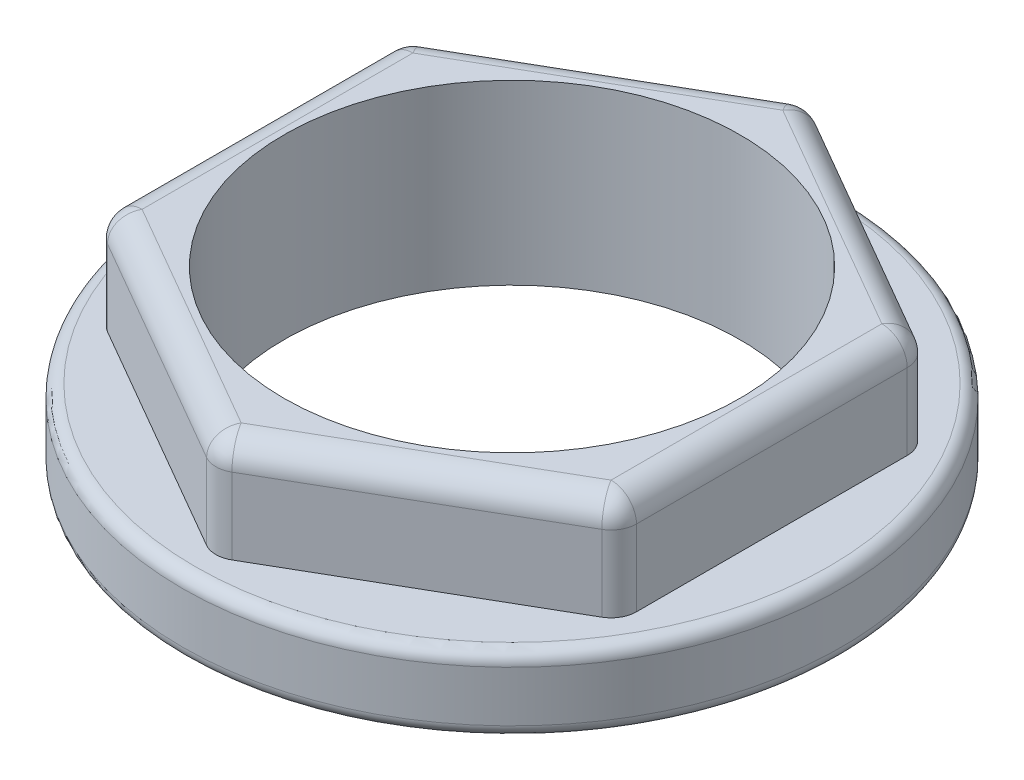
from build123d import *

# Parameters (mm, degrees)
ESQUISSE1_R        = 13
ESQUISSE1_R_2      = 9
BOSS_EXTRU_1_DEPTH = 3
ESQUISSE2_R        = 9
BOSS_EXTRU_2_DEPTH = 4
CONG_2_R           = 1
CONG_3_R           = 0.5


with BuildPart() as part:
    # Esquisse1 → Boss.-Extru.1 (new body)
    with BuildSketch(Plane(origin=(0, 0, 0), x_dir=(1, 0, 0), z_dir=(0, 1, 0))):
        with Locations(Location((0, 0, 0), (0, 0, 270))):
            Circle(ESQUISSE1_R)
        with Locations(Location((0, 0, 0), (0, 0, 270))):
            Circle(ESQUISSE1_R_2, mode=Mode.SUBTRACT)
    extrude(amount=BOSS_EXTRU_1_DEPTH)

    # Esquisse2 → Boss.-Extru.2 (add)
    with BuildSketch(Plane(origin=(0, 3, 0), x_dir=(1, 0, 0), z_dir=(0, 1, 0))):
        Polygon((10.25, -5.917840259), (10.25, 5.917840259), (0, 11.835680518), (-10.25, 5.917840259), (-10.25, -5.917840259), (0, -11.835680518), align=None)
        with Locations(Location((0, 0, 0), (0, 0, 270))):
            Circle(ESQUISSE2_R, mode=Mode.SUBTRACT)
    extrude(amount=BOSS_EXTRU_2_DEPTH)

    # Congé2
    cong_2_edges = [part.edges().sort_by_distance(p)[0] for p in [
        (5.125, 7, 8.876760389),
        (10.25, 7, 0),
        (5.125, 7, -8.876760389),
        (-5.125, 7, -8.876760389),
        (-10.25, 7, 0),
        (-5.125, 7, 8.876760389),
        (0, 5, 11.835680518),
        (10.25, 5, 5.917840259),
        (10.25, 5, -5.917840259),
        (0, 5, -11.835680518),
        (-10.25, 5, -5.917840259),
        (-10.25, 5, 5.917840259),
    ]]
    fillet(cong_2_edges, radius=CONG_2_R)

    # Congé3
    cong_3_edges = [part.edges().sort_by_distance(p)[0] for p in [
        (0, 0, -13),
        (0, 3, -13),
    ]]
    fillet(cong_3_edges, radius=CONG_3_R)


solid = part.part
